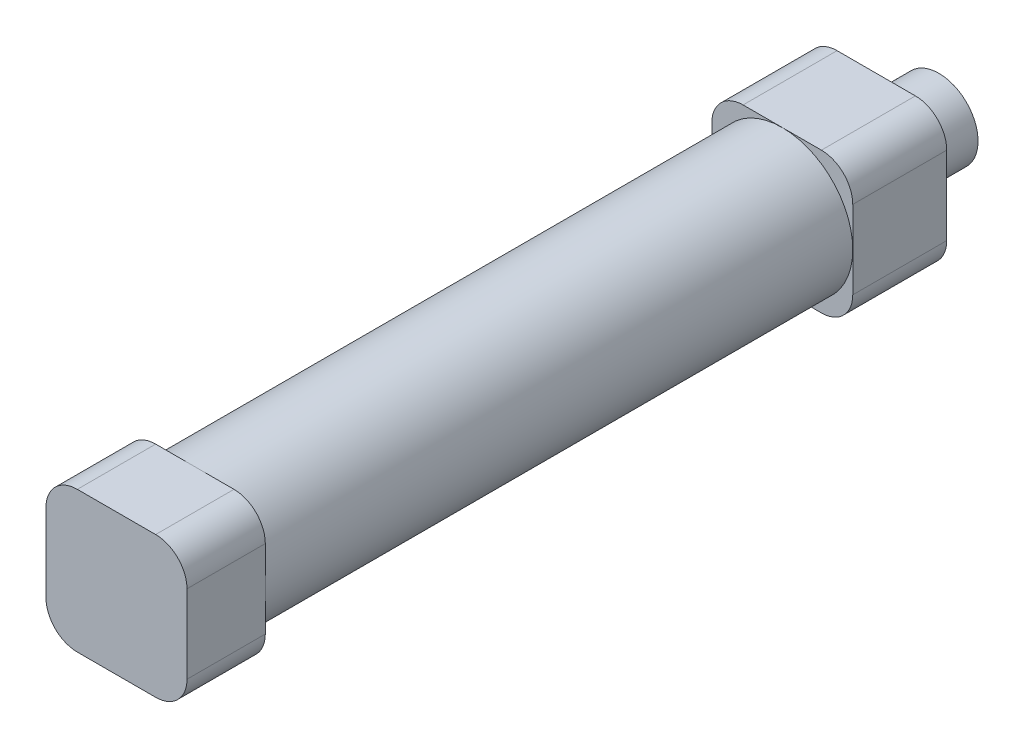
from build123d import *

# Parameters (mm, degrees)
SKETCH_1_R          = 9
SKETCH_1_R_2        = 8
EXTRUDE_1_DEPTH     = 75
EXTRUDE_2_DEPTH     = 10
EXTRUDE_START       = 12
EXTRUDE_3_DEPTH     = 12
SKETCH_4_R          = 5
EXTRUDE_4_DEPTH     = 8
SKETCH_5_R          = 2.5
CUT_EXTRUDE_1_DEPTH = 38
SKETCH_6_R          = 2
SKETCH_6_R_2        = 1.980516498
CUT_EXTRUDE_3_DEPTH = 3


with BuildPart() as part:
    # 草图1 → 凸台-拉伸1 (new body)
    with BuildSketch(Plane.XY):
        Circle(SKETCH_1_R)
        Circle(SKETCH_1_R_2, mode=Mode.SUBTRACT)
    extrude(amount=EXTRUDE_1_DEPTH)

    # 草图2 → 凸台-拉伸2 (add)
    with BuildSketch(Plane.XY.offset(75)):
        with BuildLine():
            Line((-5, -9), (5, -9))
            ThreePointArc((5, -9), (7.828427125, -7.828427125), (9, -5))
            Line((9, -5), (9, 5))
            ThreePointArc((9, 5), (7.828427125, 7.828427125), (5, 9))
            Line((5, 9), (-5, 9))
            ThreePointArc((-5, 9), (-7.828427125, 7.828427125), (-9, 5))
            Line((-9, 5), (-9, -5))
            ThreePointArc((-9, -5), (-7.828427125, -7.828427125), (-5, -9))
        make_face()
    extrude(amount=EXTRUDE_2_DEPTH)

    # 草图3 → 凸台-拉伸3 (add)
    with BuildSketch(Plane(origin=(0, 0, 0), x_dir=(-1, 0, 0), z_dir=(0, 0, -1)).offset(EXTRUDE_START)):
        with BuildLine():
            Line((-5, -9), (5, -9))
            ThreePointArc((5, -9), (7.828427125, -7.828427125), (9, -5))
            Line((9, -5), (9, 5))
            ThreePointArc((9, 5), (7.828427125, 7.828427125), (5, 9))
            Line((5, 9), (-5, 9))
            ThreePointArc((-5, 9), (-7.828427125, 7.828427125), (-9, 5))
            Line((-9, 5), (-9, -5))
            ThreePointArc((-9, -5), (-7.828427125, -7.828427125), (-5, -9))
        make_face()
    extrude(amount=-EXTRUDE_3_DEPTH)

    # 草图4 → 凸台-拉伸4 (add)
    with BuildSketch(Plane(origin=(0, 0, -12), x_dir=(-1, 0, 0), z_dir=(0, 0, -1))):
        Circle(SKETCH_4_R)
    extrude(amount=EXTRUDE_4_DEPTH)

    # 草图5 → 切除-拉伸1 (cut)
    with BuildSketch(Plane(origin=(0, 0, -20), x_dir=(-1, 0, 0), z_dir=(0, 0, -1))):
        Circle(SKETCH_5_R)
    extrude(amount=-CUT_EXTRUDE_1_DEPTH, mode=Mode.SUBTRACT)

    # 草图6 → 切除-拉伸3 (cut)
    with BuildSketch(Plane.ZY.offset(9)):
        with Locations((-4, 0)):
            Circle(SKETCH_6_R)
        with Locations((79, 0)):
            Circle(SKETCH_6_R_2)
    extrude(amount=-CUT_EXTRUDE_3_DEPTH, mode=Mode.SUBTRACT)


solid = part.part
